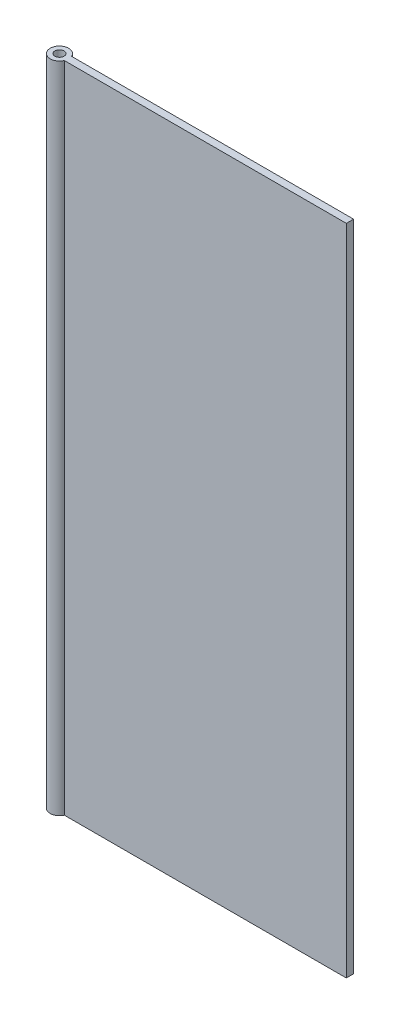
from build123d import *

# Parameters (mm, degrees)
SKETCH1_W                       = 200
SKETCH1_H                       = 450
BOSS_EXTRUDE1_DEPTH             = 2.5
BOSS_EXTRUDE2_REACH             = 398.13
SKETCH2_R                       = 6.35
BOSS_EXTRUDE2_DIRECTION_2_REACH = 398.13
SKETCH3_R                       = 3.175
CUT_EXTRUDE1_DEPTH              = 493.483829684


with BuildPart() as part:
    # Sketch1 → Boss-Extrude1 (new, symmetric)
    with BuildSketch(Plane.XY):
        with Locations((100, 116.925373314)):
            Rectangle(SKETCH1_W, SKETCH1_H)
    extrude(amount=BOSS_EXTRUDE1_DEPTH, both=True)

    # Boss-Extrude2: up to this face of the body (flat: up to its plane)
    boss_extrude2_end = Plane(part.part.faces().sort_by_distance((100, 341.925373314, 0))[0])
    # Sketch2 → Boss-Extrude2 (add, up to the picked face)
    with BuildSketch(Plane(origin=(0, 0, 0), x_dir=(1, 0, 0), z_dir=(0, 1, 0)), mode=Mode.PRIVATE) as boss_extrude2_sk1:
        Circle(SKETCH2_R)
    boss_extrude2_tool1 = split(extrude(boss_extrude2_sk1.sketch, amount=BOSS_EXTRUDE2_REACH, mode=Mode.PRIVATE), bisect_by=boss_extrude2_end, keep=Keep.BOTH, mode=Mode.PRIVATE)
    add(boss_extrude2_tool1.solids().sort_by(Axis((0, 0, 0), (0, 1, 0)))[0])

    # Boss-Extrude2 direction 2: up to this face of the body (flat: up to its plane)
    boss_extrude2_direction_2_end = Plane(part.part.faces().sort_by_distance((100, -108.074626686, 0))[0])
    # Sketch2 → Boss-Extrude2 direction 2 (add, up to the picked face)
    with BuildSketch(Plane(origin=(0, 0, 0), x_dir=(1, 0, 0), z_dir=(0, 1, 0)), mode=Mode.PRIVATE) as boss_extrude2_direction_2_sk1:
        Circle(SKETCH2_R)
    boss_extrude2_direction_2_tool1 = split(extrude(boss_extrude2_direction_2_sk1.sketch, amount=-BOSS_EXTRUDE2_DIRECTION_2_REACH, mode=Mode.PRIVATE), bisect_by=boss_extrude2_direction_2_end, keep=Keep.BOTH, mode=Mode.PRIVATE)
    add(boss_extrude2_direction_2_tool1.solids().sort_by(Axis((0, 0, 0), (0, -1, 0)))[0])

    # Sketch3 → Cut-Extrude1 (cut, through all)
    with BuildSketch(Plane(origin=(0, 341.925373314, 0), x_dir=(1, 0, 0), z_dir=(0, 1, 0))):
        with Locations(Location((0, 0, 0), (0, 0, 180))):
            Circle(SKETCH3_R)
    extrude(amount=-CUT_EXTRUDE1_DEPTH, mode=Mode.SUBTRACT)


solid = part.part
